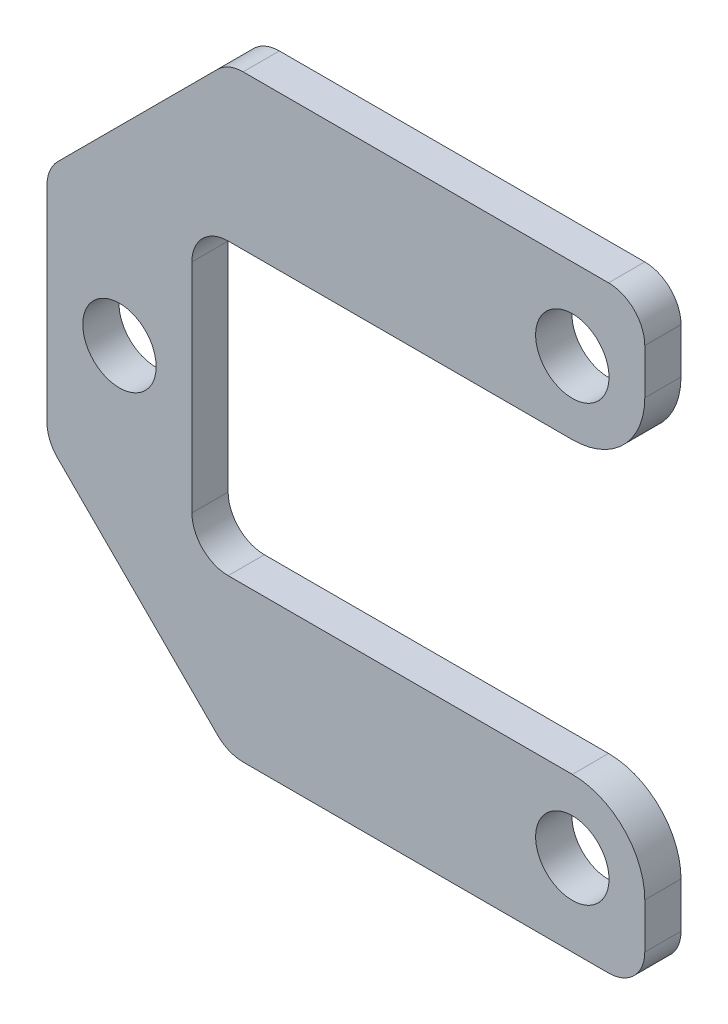
from build123d import *
from OCP.BRepFilletAPI import BRepFilletAPI_MakeFillet

# Parameters (mm, degrees)
SKETCH_1_W          = 38
SKETCH_1_H          = 33
EXTRUDE_1_DEPTH     = 2
SKETCH_2_R          = 2.025
CUT_EXTRUDE_1_DEPTH = 2
SKETCH_3_W          = 50
SKETCH_3_H          = 16
CUT_EXTRUDE_2_DEPTH = 2
FILLET_1_R1         = 2
FILLET_1_R2         = 4
SKETCH_4_W          = 5
SKETCH_4_H          = 33
CUT_EXTRUDE_3_DEPTH = 2
CHAMFER_1_SIZE      = 10
FILLET_2_R          = 2


with BuildPart() as part:
    # 草图1 → 凸台-拉伸1 (new body)
    with BuildSketch(Plane.XY):
        Rectangle(SKETCH_1_W, SKETCH_1_H)
    extrude(amount=EXTRUDE_1_DEPTH)

    # 草图2 → 切除-拉伸1 (cut)
    with BuildSketch(Plane.XY.offset(2)):
        with Locations((-10, 0)):
            Circle(SKETCH_2_R)
        with Locations((15, -12)):
            Circle(SKETCH_2_R)
        with Locations((15, 12)):
            Circle(SKETCH_2_R)
    extrude(amount=-CUT_EXTRUDE_1_DEPTH, mode=Mode.SUBTRACT)

    # 草图3 → 切除-拉伸2 (cut)
    with BuildSketch(Plane.XY.offset(2)):
        with Locations((19, 0)):
            Rectangle(SKETCH_3_W, SKETCH_3_H)
    extrude(amount=-CUT_EXTRUDE_2_DEPTH, mode=Mode.SUBTRACT)

    # 圆角1: one fillet with a radius per group of edges: ONE call of the kernel's fillet builder (fillet() takes one radius for all edges)
    fillet_1_edges_1 = [part.edges().sort_by_distance(p)[0] for p in [
        (-6, -8, 1),
        (-6, 8, 1),
        (19, -16.5, 1),
        (19, 16.5, 1),
    ]]
    fillet_1_edges_2 = [part.edges().sort_by_distance(p)[0] for p in [
        (19, 8, 1),
        (19, -8, 1),
    ]]
    fillet_1 = BRepFilletAPI_MakeFillet(part.part.solid().wrapped)
    for e in fillet_1_edges_1:
        fillet_1.Add(FILLET_1_R1, e.wrapped)
    for e in fillet_1_edges_2:
        fillet_1.Add(FILLET_1_R2, e.wrapped)
    add(Compound.cast(fillet_1.Shape()), mode=Mode.REPLACE)

    # 草图4 → 切除-拉伸3 (cut)
    with BuildSketch(Plane.XY.offset(2)):
        with Locations((-16.5, 0)):
            Rectangle(SKETCH_4_W, SKETCH_4_H)
    extrude(amount=-CUT_EXTRUDE_3_DEPTH, mode=Mode.SUBTRACT)

    # 倒角1
    chamfer_1_edges = [part.edges().sort_by_distance(p)[0] for p in [
        (-14, 16.5, 1),
        (-14, -16.5, 1),
    ]]
    chamfer(chamfer_1_edges, length=CHAMFER_1_SIZE)

    # 圆角2
    fillet_2_edges = [part.edges().sort_by_distance(p)[0] for p in [
        (-4, -16.5, 1),
        (-14, -6.5, 1),
        (-4, 16.5, 1),
        (-14, 6.5, 1),
    ]]
    fillet(fillet_2_edges, radius=FILLET_2_R)


solid = part.part
